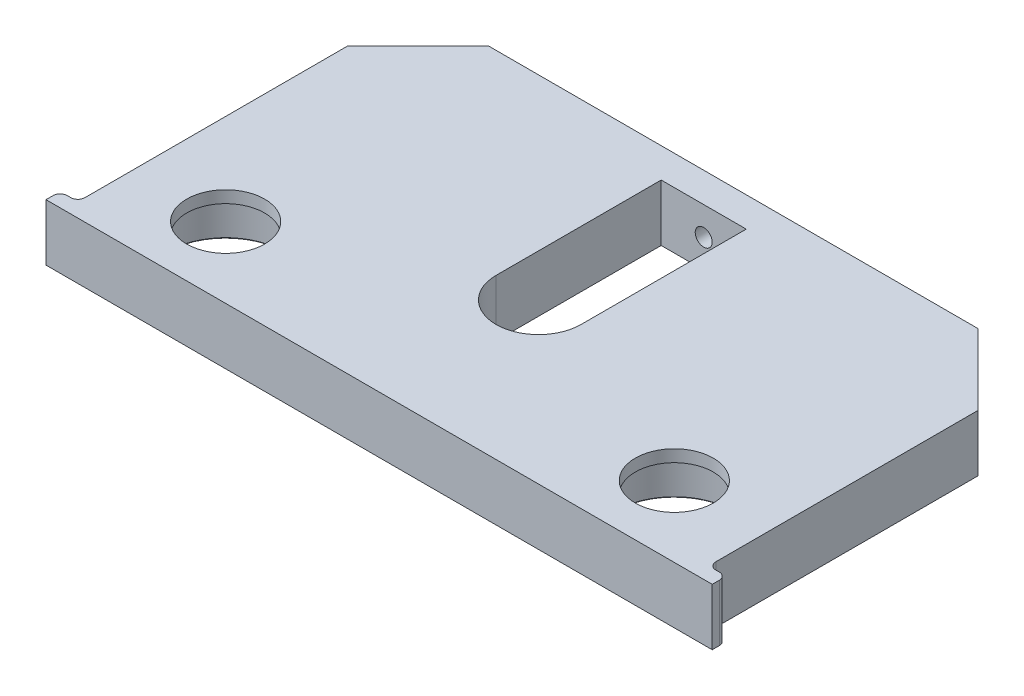
from build123d import *

# Parameters (mm, degrees)
SKETCH1_R           = 55
BOSS_EXTRUDE1_DEPTH = 40
FILLET1_R           = 10
SKETCH2_R           = 12
CUT_EXTRUDE1_DEPTH  = 80
SKETCH3_R           = 82.5
CUT_EXTRUDE2_DEPTH  = 63
CHAMFER1_SIZE       = 2


with BuildPart() as part:
    # Sketch1 → Boss-Extrude1 (new, symmetric)
    with BuildSketch(Plane(origin=(0, 0, 0), x_dir=(1, 0, 0), z_dir=(0, 1, 0))):
        Polygon((-470, 0), (-445, 0), (445, 0), (470, 0), (470, 20), (445, 20), (445, 400), (345, 500), (-345, 500), (-445, 400), (-445, 20), (-470, 20), align=None)
        with Locations(Location((-316.5, 100, 0), (0, 0, 270))):
            Circle(SKETCH1_R, mode=Mode.SUBTRACT)
        with Locations(Location((316.5, 100, 0), (0, 0, 270))):
            Circle(SKETCH1_R, mode=Mode.SUBTRACT)
        with BuildLine():
            Line((-60, 225), (-60, 458))
            Line((-60, 458), (60, 458))
            Line((60, 458), (60, 225))
            ThreePointArc((60, 225), (0, 165), (-60, 225))
        make_face(mode=Mode.SUBTRACT)
    extrude(amount=BOSS_EXTRUDE1_DEPTH, both=True)

    # Fillet1
    fillet1_edges = [part.edges().sort_by_distance(p)[0] for p in [
        (445, 0, -20),
        (470, 0, -20),
        (-470, 0, -20),
        (-445, 0, -20),
    ]]
    fillet(fillet1_edges, radius=FILLET1_R)

    # Sketch2 → Cut-Extrude1 (cut)
    with BuildSketch(Plane.XY.offset(-458)):
        Circle(SKETCH2_R)
    extrude(amount=-CUT_EXTRUDE1_DEPTH, mode=Mode.SUBTRACT)

    # Sketch3 → Cut-Extrude2 (cut)
    with BuildSketch(Plane.XZ.offset(40)):
        with Locations(Location((-316.5, -100, 0), (0, 0, 270))):
            Circle(SKETCH3_R)
        with Locations(Location((316.5, -100, 0), (0, 0, 270))):
            Circle(SKETCH3_R)
    extrude(amount=-CUT_EXTRUDE2_DEPTH, mode=Mode.SUBTRACT)

    # Chamfer1
    chamfer1_edges = [part.edges().sort_by_distance(p)[0] for p in [
        (-316.5, 23, -17.5),
        (-316.5, -40, -17.5),
        (316.5, -40, -17.5),
        (316.5, 23, -17.5),
    ]]
    chamfer(chamfer1_edges, length=CHAMFER1_SIZE)


solid = part.part
